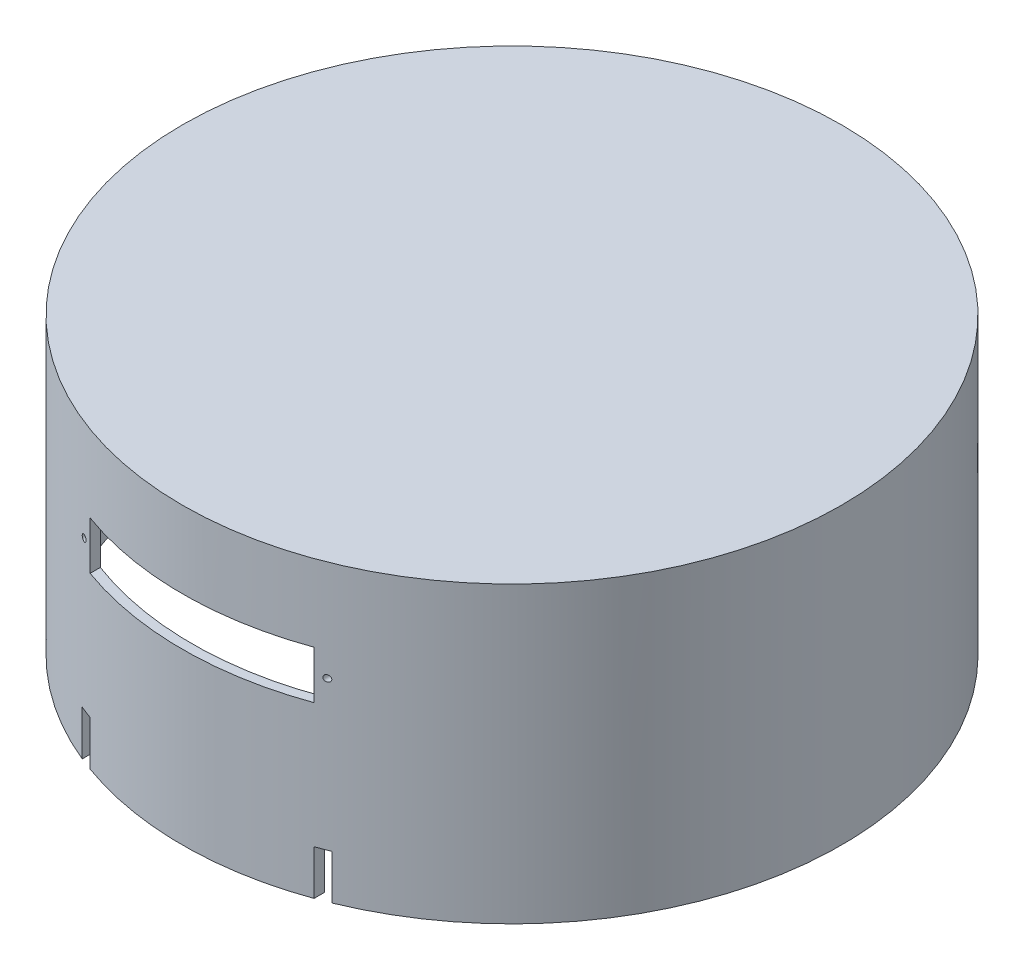
from build123d import *

# Parameters (mm, degrees)
SKETCH_1_R               = 103
SKETCH_1_R_2             = 100
EXTRUDE_1_DEPTH          = 63
SKETCH_2_R               = 103
EXTRUDE_2_DEPTH          = 2
SKETCH_4_W               = 2
SKETCH_4_H               = 60
SKETCH_4_W_2             = 120
SKETCH_4_H_2             = 2
EXTRUDE_3_DEPTH          = 10
SKETCH_5_R               = 1
SKETCH_5_W               = 70
SKETCH_5_H               = 15
CUT_EXTRUDE_1_DEPTH      = 1000
EXTRUDE_4_DEPTH          = 20
CUT_EXTRUDE_2_DEPTH      = 150
SKETCH_10_W              = 120
SKETCH_10_H              = 2
SKETCH_10_W_2            = 2
SKETCH_10_H_2            = 60
CUT_EXTRUDE_3_DEPTH      = 5
SKETCH_11_W              = 3.150152901
SKETCH_11_H              = 6.664382079
SKETCH_11_W_2            = 3.458582199
SKETCH_11_H_2            = 6.22916057
CUT_EXTRUDE_4_DEPTH      = 5
EXTRUDE_START            = 17
SKETCH_13_R              = 103
SKETCH_13_R_2            = 100
EXTRUDE_5_DEPTH          = 17
SKETCH_15_W              = 4
SKETCH_15_H              = 4.789562653
CUT_EXTRUDE_5_DEPTH      = 4
CUT_EXTRUDE_6_DEPTH      = 15
CUT_EXTRUDE_6_DEPTH_BACK = 4
SKETCH_16_W              = 4
SKETCH_16_H              = 4.789562653
EXTRUDE_START_2          = 10
SKETCH_18_R              = 103
SKETCH_18_R_2            = 100
EXTRUDE_6_DEPTH          = 10
SKETCH_19_W              = 4
SKETCH_19_H              = 4.789562653
CUT_EXTRUDE_7_DEPTH      = 10


with BuildPart() as part:
    # 草图1 → 凸台-拉伸1 (new body)
    with BuildSketch(Plane(origin=(0, 0, 0), x_dir=(1, 0, 0), z_dir=(0, 1, 0))):
        with Locations(Location((0, 0, 0), (0, 0, 270))):
            Circle(SKETCH_1_R)
        with Locations(Location((0, 0, 0), (0, 0, 270))):
            Circle(SKETCH_1_R_2, mode=Mode.SUBTRACT)
    extrude(amount=EXTRUDE_1_DEPTH)

    # 草图2 → 凸台-拉伸2 (add)
    with BuildSketch(Plane(origin=(0, 63, 0), x_dir=(1, 0, 0), z_dir=(0, 1, 0))):
        with Locations(Location((0, 0, 0), (0, 0, 270))):
            Circle(SKETCH_2_R)
    extrude(amount=EXTRUDE_2_DEPTH)

    # 草图4 → 凸台-拉伸3 (add)
    with BuildSketch(Plane.XZ.offset(-63)):
        with Locations((-66, -30)):
            Rectangle(SKETCH_4_W, SKETCH_4_H)
        with Locations((66, -30)):
            Rectangle(SKETCH_4_W, SKETCH_4_H)
        with Locations((0, 1)):
            Rectangle(SKETCH_4_W_2, SKETCH_4_H_2)
    extrude(amount=EXTRUDE_3_DEPTH)

    # 草图5 → 切除-拉伸1 (cut)
    with BuildSketch(Plane.XY.offset(2)):
        with Locations(Location((-38, 33.5, 0), (0, 0, 180))):
            Circle(SKETCH_5_R)
        with Locations(Location((38, 33.5, 0), (0, 0, 180))):
            Circle(SKETCH_5_R)
        with Locations((0, 33.5)):
            Rectangle(SKETCH_5_W, SKETCH_5_H)
    extrude(amount=CUT_EXTRUDE_1_DEPTH, mode=Mode.SUBTRACT)

    # 草图6 → 凸台-拉伸4 (add)
    with BuildSketch(Plane.XZ.offset(-63)):
        Polygon((-85, 5), (-85, 33), (53.5, 33), (53.5, 31.5), (-83.5, 31.5), (-83.5, 6.5), (53.5, 6.5), (53.5, 5), align=None)
    extrude(amount=EXTRUDE_4_DEPTH)

    # 草图7 → 切除-拉伸2 (cut)
    with BuildSketch(Plane(origin=(0, 0, 0), x_dir=(-1, 0, 0), z_dir=(0, 0, -1))):
        Polygon((-72, 63), (-67, 63), (-67, 53), (-65, 53), (-65, 63), (65, 63), (65, 53), (67, 53), (67, 63), (72, 63), (72, 23), (-72, 23), align=None)
    extrude(amount=CUT_EXTRUDE_2_DEPTH, mode=Mode.SUBTRACT)

    # 草图10 → 切除-拉伸3 (cut)
    with BuildSketch(Plane.XZ.offset(-53)):
        with Locations((0, 1)):
            Rectangle(SKETCH_10_W, SKETCH_10_H)
        with Locations((-66, -30)):
            Rectangle(SKETCH_10_W_2, SKETCH_10_H_2)
        with Locations((66, -30)):
            Rectangle(SKETCH_10_W_2, SKETCH_10_H_2)
    extrude(amount=-CUT_EXTRUDE_3_DEPTH, mode=Mode.SUBTRACT)

    # 草图11 → 切除-拉伸4 (cut)
    with BuildSketch(Plane.XZ.offset(-53)):
        with Locations((-66.11313156, -76.941337865)):
            Rectangle(SKETCH_11_W, SKETCH_11_H)
        with Locations((65.709980809, -77.158948619)):
            Rectangle(SKETCH_11_W_2, SKETCH_11_H_2)
    extrude(amount=-CUT_EXTRUDE_4_DEPTH, mode=Mode.SUBTRACT)

    # 草图13 → 凸台-拉伸5 (add)
    with BuildSketch(Plane.XZ.offset(EXTRUDE_START)):
        with Locations(Location((0, 0, 0), (0, 0, 270))):
            Circle(SKETCH_13_R)
        with Locations(Location((0, 0, 0), (0, 0, 270))):
            Circle(SKETCH_13_R_2, mode=Mode.SUBTRACT)
    extrude(amount=-EXTRUDE_5_DEPTH)

    # 草图15 → 切除-拉伸5 (cut)
    with BuildSketch(Plane.XZ.offset(17)):
        Polygon((-39, 95.331002303), (-39, 92.081485653), (-35, 92.081485653), (-35, 100), (-39, 100), align=None)
        with Locations((37, 94.476266979)):
            Rectangle(SKETCH_15_W, SKETCH_15_H)
    extrude(amount=-CUT_EXTRUDE_5_DEPTH, mode=Mode.SUBTRACT)

    # 草图16 → 切除-拉伸6 (cut, two sides: drawn at the far end of the back side and taken through both)
    with BuildSketch(Plane.XZ.offset(17).offset(-CUT_EXTRUDE_6_DEPTH_BACK)):
        with Locations((37, -94.476266979)):
            Rectangle(SKETCH_16_W, SKETCH_16_H)
        with Locations((-37, -94.476266979)):
            Rectangle(SKETCH_16_W, SKETCH_16_H)
    extrude(amount=CUT_EXTRUDE_6_DEPTH + CUT_EXTRUDE_6_DEPTH_BACK, mode=Mode.SUBTRACT)

    # 草图18 → 凸台-拉伸6 (add)
    with BuildSketch(Plane.XZ.offset(17).offset(EXTRUDE_START_2)):
        with Locations(Location((0, 0, 0), (0, 0, 270))):
            Circle(SKETCH_18_R)
        with Locations(Location((0, 0, 0), (0, 0, 270))):
            Circle(SKETCH_18_R_2, mode=Mode.SUBTRACT)
    extrude(amount=-EXTRUDE_6_DEPTH)

    # 草图19 → 切除-拉伸7 (cut)
    with BuildSketch(Plane.XZ.offset(27)):
        with Locations((-37, -94.476266979)):
            Rectangle(SKETCH_19_W, SKETCH_19_H)
        with Locations((37, -94.476266979)):
            Rectangle(SKETCH_19_W, SKETCH_19_H)
        with Locations((-37, 94.476266979)):
            Rectangle(SKETCH_19_W, SKETCH_19_H)
        with Locations((37, 94.476266979)):
            Rectangle(SKETCH_19_W, SKETCH_19_H)
    extrude(amount=-CUT_EXTRUDE_7_DEPTH, mode=Mode.SUBTRACT)


solid = part.part
